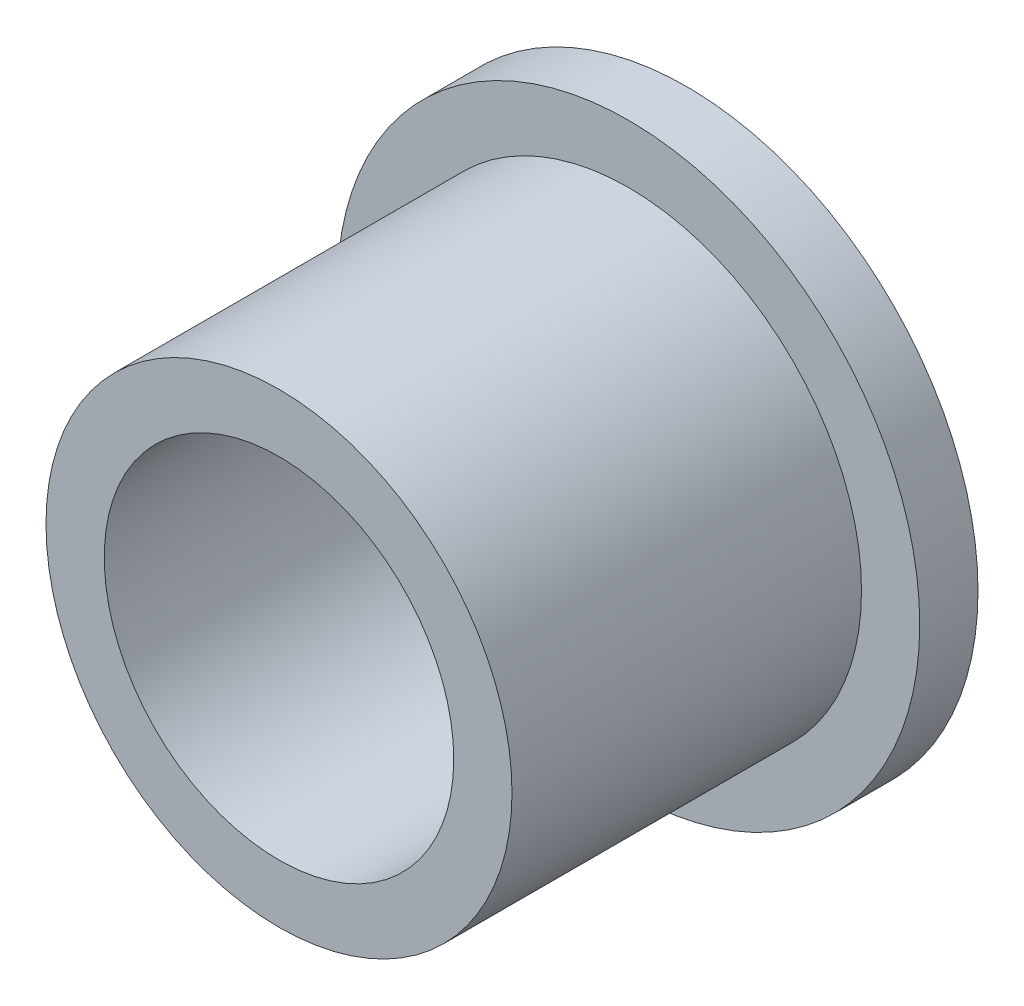
from build123d import *

# Parameters (mm, degrees)
SKETCH2_R           = 15
BOSS_EXTRUDE1_DEPTH = 3
SKETCH3_R           = 12
BOSS_EXTRUDE2_DEPTH = 18
SKETCH4_R           = 9
CUT_EXTRUDE1_DEPTH  = 21


with BuildPart() as part:
    # Sketch2 → Boss-Extrude1 (new body)
    with BuildSketch(Plane.XY):
        Circle(SKETCH2_R)
    extrude(amount=BOSS_EXTRUDE1_DEPTH)

    # Sketch3 → Boss-Extrude2 (add)
    with BuildSketch(Plane.XY.offset(3)):
        Circle(SKETCH3_R)
    extrude(amount=BOSS_EXTRUDE2_DEPTH)

    # Sketch4 → Cut-Extrude1 (cut)
    with BuildSketch(Plane.XY.offset(21)):
        Circle(SKETCH4_R)
    extrude(amount=-CUT_EXTRUDE1_DEPTH, mode=Mode.SUBTRACT)


solid = part.part
